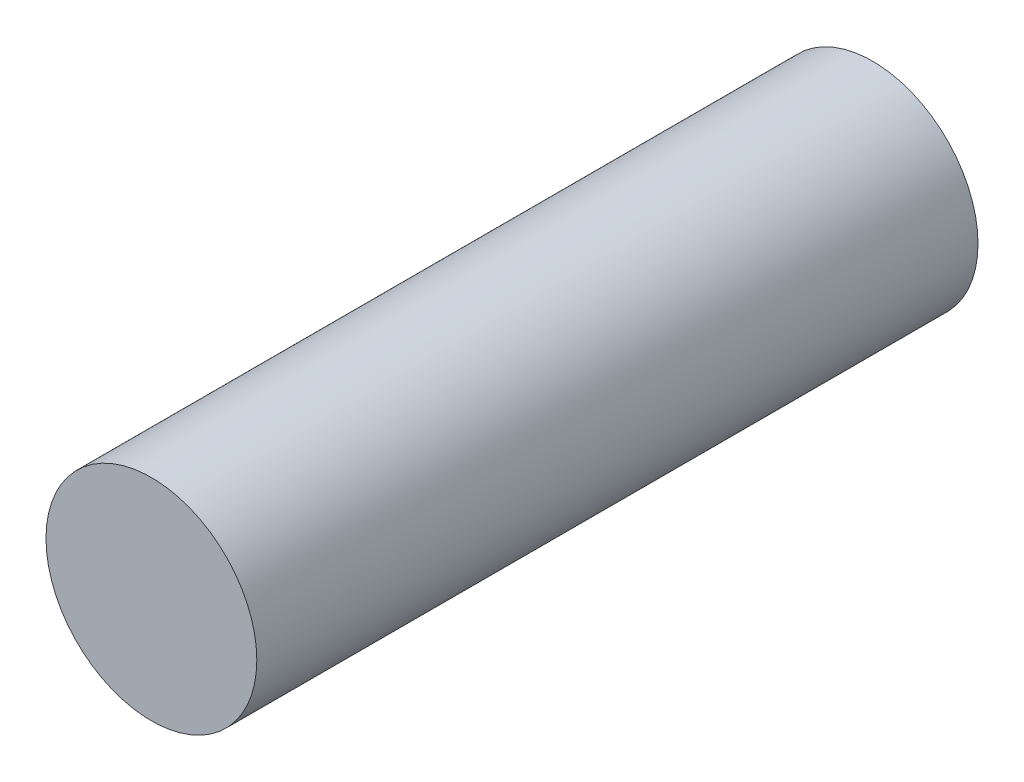
from build123d import *

# Parameters (mm, degrees)
ESQUISSE1_R        = 9.5
BOSS_EXTRU_1_DEPTH = 65


with BuildPart() as part:
    # Esquisse1 → Boss.-Extru.1 (new body)
    with BuildSketch(Plane.XY):
        Circle(ESQUISSE1_R)
    extrude(amount=BOSS_EXTRU_1_DEPTH)


solid = part.part
